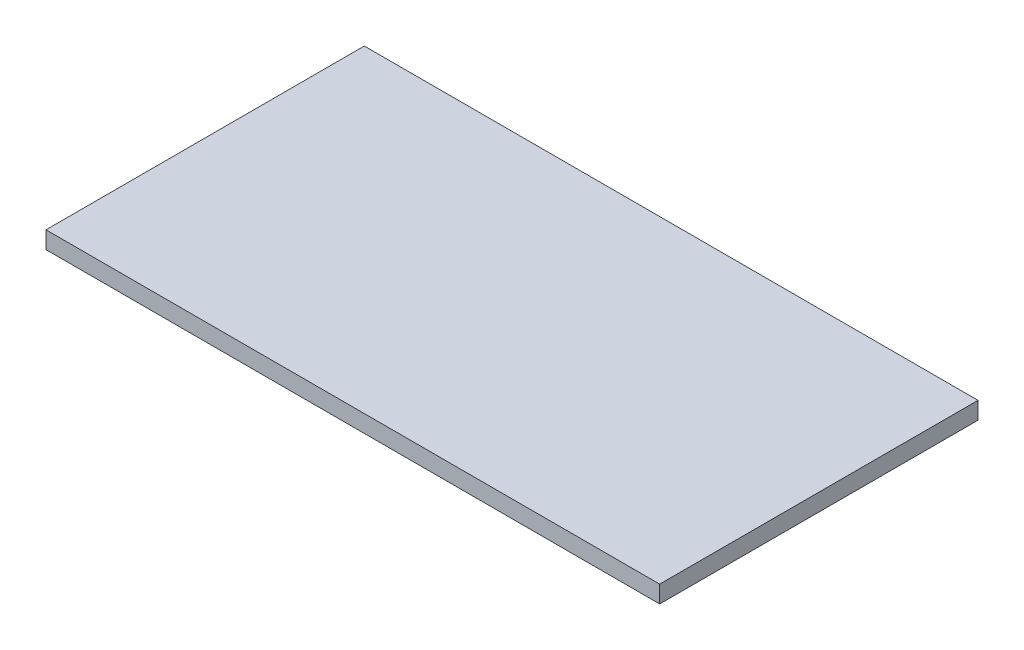
from build123d import *

# Parameters (mm, degrees)
SKETCH1_W           = 214
SKETCH1_H           = 111
BOSS_EXTRUDE1_DEPTH = 6


with BuildPart() as part:
    # Sketch1 → Boss-Extrude1 (new body)
    with BuildSketch(Plane(origin=(0, 0, 0), x_dir=(1, 0, 0), z_dir=(0, 1, 0))):
        with Locations((107, 55.5)):
            Rectangle(SKETCH1_W, SKETCH1_H)
    extrude(amount=BOSS_EXTRUDE1_DEPTH)


solid = part.part
